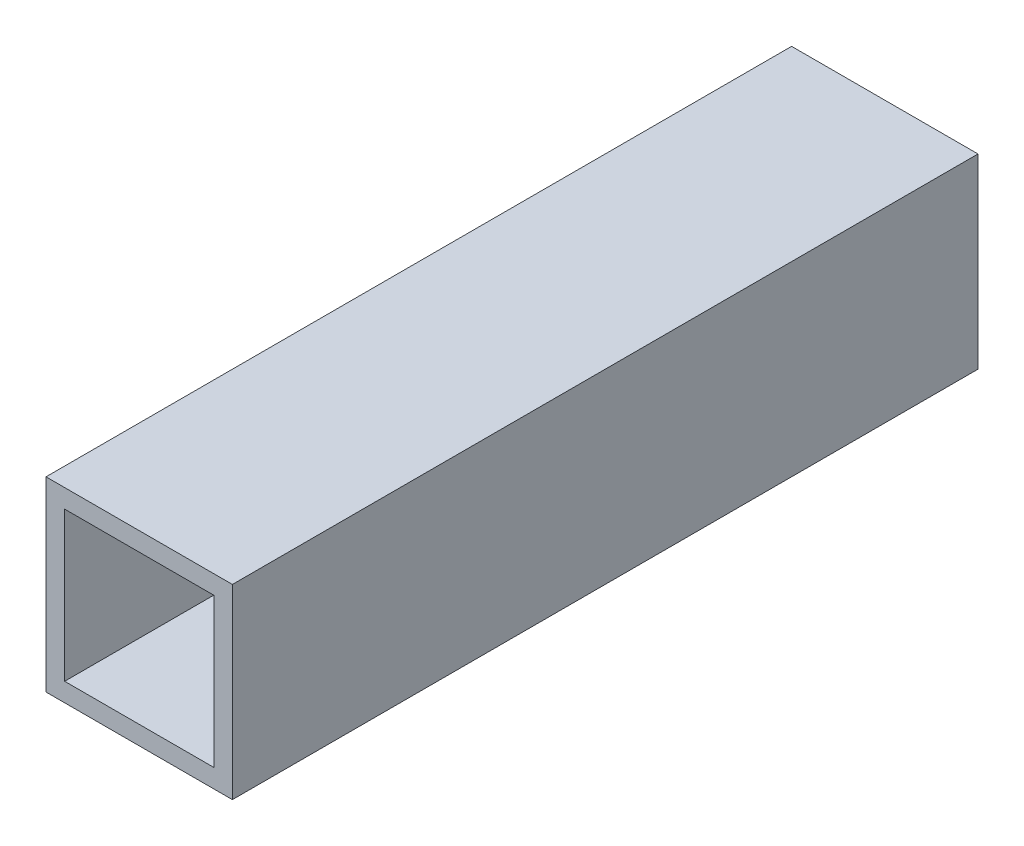
from build123d import *

# Parameters (mm, degrees)
SKETCH1_W           = 50
SKETCH1_H           = 50
SKETCH1_W_2         = 40
SKETCH1_H_2         = 40
BOSS_EXTRUDE1_DEPTH = 200


with BuildPart() as part:
    # Sketch1 → Boss-Extrude1 (new body)
    with BuildSketch(Plane.XY):
        Rectangle(SKETCH1_W, SKETCH1_H)
        Rectangle(SKETCH1_W_2, SKETCH1_H_2, mode=Mode.SUBTRACT)
    extrude(amount=BOSS_EXTRUDE1_DEPTH)


solid = part.part
